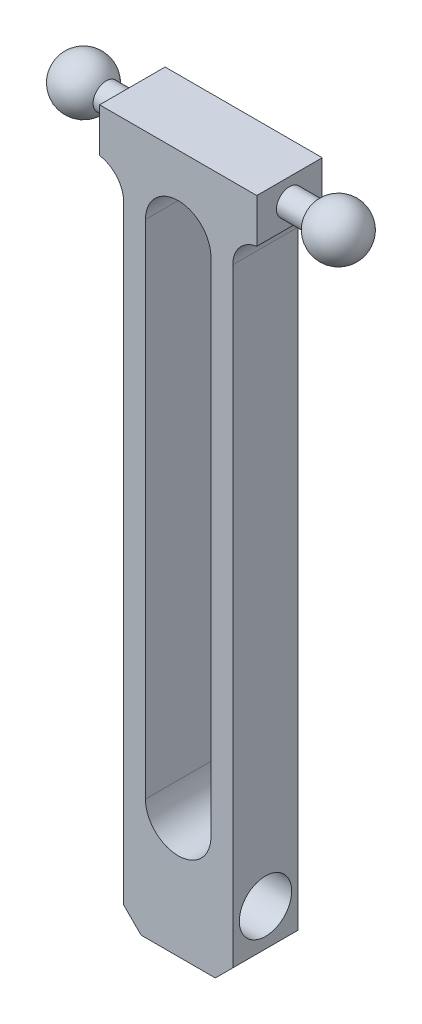
from build123d import *

# Parameters (mm, degrees)
AUFSATZ_LINEAR_AUSTRAGEN1_DEPTH = 7.5
SCHNITT_LINEAR_AUSTRAGEN1_DEPTH = 10
SKIZZE7_R                       = 3
SCHNITT_LINEAR_AUSTRAGEN4_DEPTH = 84.113251049
M4_GEWINDEBOHRUNG1_D            = 3.3
M4_GEWINDEBOHRUNG1_DEPTH        = 7.5
M4_GEWINDEBOHRUNG1_TIP          = 0.991420021
SKIZZE9_OUTSIDE_W               = 26.654
SKIZZE9_OUTSIDE_H               = 99.154
SKIZZE9_OUTSIDE_R               = 1.5
SCHNITT_LINEAR_AUSTRAGEN5_DEPTH = 6
SKIZZE10_OUTSIDE_W              = 26.654
SKIZZE10_OUTSIDE_H              = 99.154
SKIZZE10_OUTSIDE_R              = 1.5
SCHNITT_LINEAR_AUSTRAGEN6_DEPTH = 6


with BuildPart() as part:
    # Skizze1 → Aufsatz-Linear austragen1 (new body)
    with BuildSketch(Plane.XY):
        with BuildLine():
            Line((-8.75, 75), (-3.25, 75))
            ThreePointArc((-3.25, 75), (-0.951902961, 74.048097039), (0, 71.75))
            Line((0, 71.75), (0, 2))
            Line((0, 2), (2, 0))
            Line((2, 0), (10.5, 0))
            Line((10.5, 0), (12.5, 2))
            Line((12.5, 2), (12.5, 71.75))
            ThreePointArc((12.5, 71.75), (13.451902961, 74.048097039), (15.75, 75))
            Line((15.75, 75), (21.25, 75))
            Line((21.25, 75), (21.25, 80))
            Line((21.25, 80), (-8.75, 80))
            Line((-8.75, 80), (-8.75, 75))
        make_face()
    extrude(amount=AUFSATZ_LINEAR_AUSTRAGEN1_DEPTH)

    # Skizze2 → Schnitt-Linear austragen1 (cut)
    with BuildSketch(Plane.XY.offset(7.5)):
        with BuildLine():
            Line((10, 71.25), (10, 13.75))
            ThreePointArc((10, 13.75), (6.25, 10), (2.5, 13.75))
            Line((2.5, 13.75), (2.5, 71.25))
            ThreePointArc((2.5, 71.25), (6.25, 75), (10, 71.25))
        make_face()
    extrude(amount=-SCHNITT_LINEAR_AUSTRAGEN1_DEPTH, mode=Mode.SUBTRACT)

    # Skizze7 → Schnitt-Linear austragen4 (cut, through all)
    with BuildSketch(Plane(origin=(12.5, 0, 0), x_dir=(0, 0, -1), z_dir=(1, 0, 0))):
        with Locations(Location((-3.75, 6.25, 0), (0, 0, 90))):
            Circle(SKIZZE7_R)
    extrude(amount=-SCHNITT_LINEAR_AUSTRAGEN4_DEPTH, mode=Mode.SUBTRACT)

    # M4 Gewindebohrung1
    with Locations(Plane(origin=(6.25, 0, 3.75), x_dir=(0, 0, -1), z_dir=(0, -1, 0))):
        with Locations((0, 0)):
            Hole(M4_GEWINDEBOHRUNG1_D / 2, depth=M4_GEWINDEBOHRUNG1_DEPTH)
            with Locations((0, 0, -(M4_GEWINDEBOHRUNG1_DEPTH + M4_GEWINDEBOHRUNG1_TIP / 2))):  # 118° drill point
                Cone(0, M4_GEWINDEBOHRUNG1_D / 2, M4_GEWINDEBOHRUNG1_TIP, mode=Mode.SUBTRACT)

    # Skizze9 outside → Schnitt-Linear austragen5 (cut)
    with BuildSketch(Plane(origin=(21.25, 0, 0), x_dir=(0, 0, -1), z_dir=(1, 0, 0))):
        with Locations((-3.75, 40)):
            Rectangle(SKIZZE9_OUTSIDE_W, SKIZZE9_OUTSIDE_H)
        with Locations((-3.75, 77.5)):
            Circle(SKIZZE9_OUTSIDE_R, mode=Mode.SUBTRACT)
    extrude(amount=-SCHNITT_LINEAR_AUSTRAGEN5_DEPTH, mode=Mode.SUBTRACT)

    # Skizze10 outside → Schnitt-Linear austragen6 (cut)
    with BuildSketch(Plane.ZY.offset(8.75)):
        with Locations((3.75, 40)):
            Rectangle(SKIZZE10_OUTSIDE_W, SKIZZE10_OUTSIDE_H)
        with Locations(Location((3.75, 77.5, 0), (0, 0, 180))):
            Circle(SKIZZE10_OUTSIDE_R, mode=Mode.SUBTRACT)
    extrude(amount=-SCHNITT_LINEAR_AUSTRAGEN6_DEPTH, mode=Mode.SUBTRACT)

    # Skizze11 → Rotation2 (revolve)
    with BuildSketch(Plane(origin=(0, 77.5, 0), x_dir=(1, 0, 0), z_dir=(0, 1, 0))):
        with BuildLine():
            Line((18.25, -2.25), (18.25, -3.75))
            Line((18.25, -3.75), (23.848076211, -3.75))
            ThreePointArc((23.848076211, -3.75), (21.624533347, -0.852222521), (18.25, -2.25))
        make_face()
        with BuildLine():
            Line((-5.75, -2.25), (-5.75, -3.75))
            Line((-5.75, -3.75), (-11.348076211, -3.75))
            ThreePointArc((-11.348076211, -3.75), (-9.124533347, -0.852222521), (-5.75, -2.25))
        make_face()
    revolve(axis=Axis((-8.75, 77.5, 3.75), (1, 0, 0)))


solid = part.part
